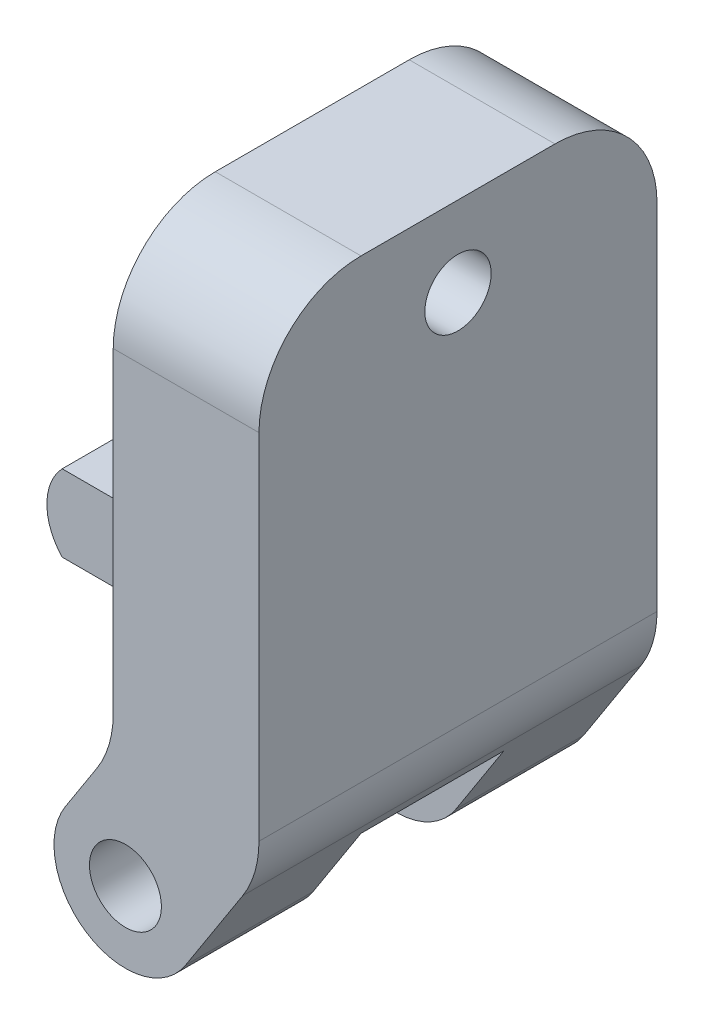
from build123d import *

# Parameters (mm, degrees)
BOSS_EXTRUDE1_DEPTH = 6.35
BOSS_EXTRUDE2_DEPTH = 7.112
BOSS_EXTRUDE3_START = 6.35
BOSS_EXTRUDE3_DEPTH = 6.35
CUT_EXTRUDE1_REACH  = 37.909
SKETCH5_R           = 1.7907
CUT_EXTRUDE2_REACH  = 37.909
SKETCH6_R           = 1.524
SKETCH7_R           = 1.651
CUT_EXTRUDE3_DEPTH  = 24.282660099
SKETCH9_W           = 13
SKETCH9_H           = 3.81
BOSS_EXTRUDE4_DEPTH = 5.334
CUT_EXTRUDE4_DEPTH  = 34.50981373
SKETCH11_W          = 5.842
SKETCH11_H          = 8.036223638
CUT_EXTRUDE5_DEPTH  = 23.149777145
FILLET2_R           = 1.27
FILLET3_R           = 5.08
FILLET4_R           = 5.08


with BuildPart() as part:
    # Sketch2 → Boss-Extrude1 (new body)
    with BuildSketch(Plane.XY):
        with BuildLine():
            Line((21.644583215, -14.393094274), (25.301992713, -8.71448479))
            Line((25.301992713, -8.71448479), (25.301992713, 15.4724))
            Line((25.301992713, 15.4724), (18.047240712, 15.4724))
            Line((18.047240712, 15.4724), (18.047240712, -6.844010681))
            Line((18.047240712, -6.844010681), (15.665416785, -10.542105726))
            ThreePointArc((15.665416785, -10.542105726), (16.729505726, -15.457183215), (21.644583215, -14.393094274))
        make_face()
    extrude(amount=BOSS_EXTRUDE1_DEPTH)

    # Sketch3 → Boss-Extrude2 (add)
    with BuildSketch(Plane(origin=(0, 0, 0), x_dir=(-1, 0, 0), z_dir=(0, 0, -1))):
        Polygon((-18.047240712, -6.844010681), (-24.026407143, -10.694999229), (-25.301992713, -8.71448479), (-25.301992713, 15.4724), (-18.047240712, 15.4724), align=None)
    extrude(amount=BOSS_EXTRUDE2_DEPTH)

    # Sketch4 → Boss-Extrude3 (add)
    with BuildSketch(Plane(origin=(0, 0, -7.112), x_dir=(-1, 0, 0), z_dir=(0, 0, -1)).offset(BOSS_EXTRUDE3_START)):
        with BuildLine():
            Line((-25.301992713, 15.4724), (-25.301992713, -8.71448479))
            Line((-25.301992713, -8.71448479), (-21.644583215, -14.393094274))
            ThreePointArc((-21.644583215, -14.393094274), (-16.729505726, -15.457183215), (-15.665416785, -10.542105726))
            Line((-15.665416785, -10.542105726), (-18.047240712, -6.844010681))
            Line((-18.047240712, -6.844010681), (-18.047240712, 15.4724))
            Line((-18.047240712, 15.4724), (-25.301992713, 15.4724))
        make_face()
    extrude(amount=-BOSS_EXTRUDE3_DEPTH)

    # Sketch5 → Cut-Extrude1 (cut, up to next)
    with BuildSketch(Plane.XY.offset(6.35), mode=Mode.PRIVATE) as cut_extrude1_sk1:
        with Locations((18.655, -12.4676)):
            Circle(SKETCH5_R)
    cut_extrude1_tool1 = extrude(cut_extrude1_sk1.sketch, amount=-CUT_EXTRUDE1_REACH, mode=Mode.PRIVATE) & part.part
    add(cut_extrude1_tool1.solids().sort_by_distance((18.655, -12.4676, 6.35))[0], mode=Mode.SUBTRACT)

    # Sketch6 → Cut-Extrude2 (cut, up to next)
    with BuildSketch(Plane(origin=(0, 0, -13.462), x_dir=(-1, 0, 0), z_dir=(0, 0, -1)), mode=Mode.PRIVATE) as cut_extrude2_sk1:
        with Locations((-18.655, -12.4676)):
            Circle(SKETCH6_R)
    cut_extrude2_tool1 = extrude(cut_extrude2_sk1.sketch, amount=-CUT_EXTRUDE2_REACH, mode=Mode.PRIVATE) & part.part
    add(cut_extrude2_tool1.solids().sort_by_distance((18.655, -12.4676, -13.462))[0], mode=Mode.SUBTRACT)

    # Sketch7 → Cut-Extrude3 (cut, through all)
    with BuildSketch(Plane(origin=(25.301992713, 0, 0), x_dir=(0, 0, -1), z_dir=(1, 0, 0))):
        with Locations((3.556, 11.47952)):
            Circle(SKETCH7_R)
    extrude(amount=-CUT_EXTRUDE3_DEPTH, mode=Mode.SUBTRACT)

    # Sketch9 → Boss-Extrude4 (add)
    with BuildSketch(Plane.ZY.offset(-18.047240712)):
        with Locations((-2.182, 0.00126)):
            Rectangle(SKETCH9_W, SKETCH9_H)
    extrude(amount=BOSS_EXTRUDE4_DEPTH)

    # Sketch10 → Cut-Extrude4 (cut, through all)
    with BuildSketch(Plane(origin=(0, 0, -8.682), x_dir=(-1, 0, 0), z_dir=(0, 0, -1))):
        with BuildLine():
            Line((-13.475240712, 1.90626), (-13.475240712, 3.862647324))
            Line((-13.475240712, 3.862647324), (-11.787992586, 3.862647324))
            Line((-11.787992586, 3.862647324), (-11.787992586, -3.9659176))
            Line((-11.787992586, -3.9659176), (-13.475240712, -3.9659176))
            Line((-13.475240712, -3.9659176), (-13.475240712, -1.90374))
            ThreePointArc((-13.475240712, -1.90374), (-12.713240712, 0.00126), (-13.475240712, 1.90626))
        make_face()
    extrude(amount=-CUT_EXTRUDE4_DEPTH, mode=Mode.SUBTRACT)

    # Sketch11 → Cut-Extrude5 (cut, through all)
    with BuildSketch(Plane.ZY.offset(-18.047240712)):
        with Locations((-3.094, 0.00126)):
            Rectangle(SKETCH11_W, SKETCH11_H)
    extrude(amount=CUT_EXTRUDE5_DEPTH, mode=Mode.SUBTRACT)

    # Fillet2
    fillet2_edges = [part.edges().sort_by_distance(p)[0] for p in [
        (18.047240712, 1.90626, 2.0725),
        (18.047240712, 0.00126, 4.318),
        (18.047240712, -1.90374, 2.0725),
        (18.047240712, 0.00126, -0.173),
        (18.047240712, 0.00126, -8.682),
        (18.047240712, -1.90374, -7.3485),
        (18.047240712, 1.90626, -7.3485),
        (18.047240712, 0.00126, -6.015),
    ]]
    fillet(fillet2_edges, radius=FILLET2_R)

    # Fillet3
    fillet3_edges = [part.edges().sort_by_distance(p)[0] for p in [
        (21.674616713, 15.4724, -13.462),
        (21.674616713, 15.4724, 6.35),
    ]]
    fillet(fillet3_edges, radius=FILLET3_R)

    # Fillet4
    fillet4_edges = [part.edges().sort_by_distance(p)[0] for p in [
        (25.301992713, -8.71448479, -3.556),
        (18.047240712, -6.844010681, 3.175),
        (18.047240712, -6.844010681, -10.287),
    ]]
    fillet(fillet4_edges, radius=FILLET4_R)


solid = part.part
